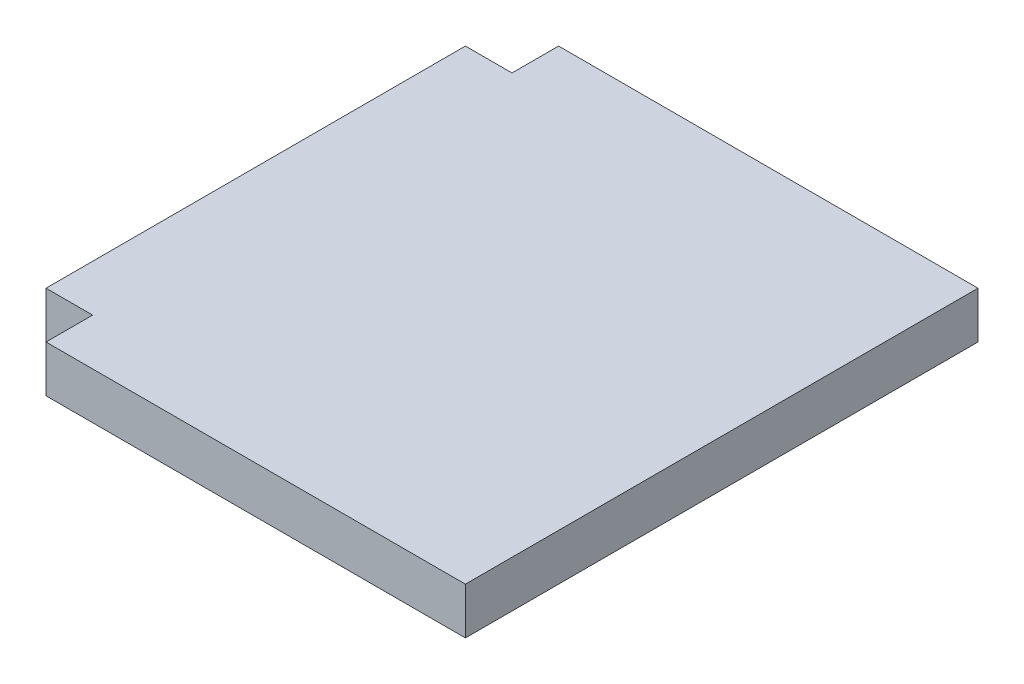
from build123d import *

# Parameters (mm, degrees)
CROQUIS1_W              = 500
CROQUIS1_H              = 550
SALIENTE_EXTRUIR1_DEPTH = 50
CROQUIS2_W              = 50
CROQUIS2_H              = 50
CORTAR_EXTRUIR1_DEPTH   = 50
MATRIZL1_COUNT          = 2
MATRIZL1_PITCH          = 500


with BuildPart() as part:
    # Croquis1 → Saliente-Extruir1 (new body)
    with BuildSketch(Plane(origin=(0, 0, 0), x_dir=(1, 0, 0), z_dir=(0, 1, 0))):
        Rectangle(CROQUIS1_W, CROQUIS1_H)
    extrude(amount=SALIENTE_EXTRUIR1_DEPTH)

    # Croquis2 → Cortar-Extruir1 (cut)
    with BuildSketch(Plane(origin=(0, 50, 0), x_dir=(1, 0, 0), z_dir=(0, 1, 0))):
        with Locations((-225, 250)):
            Rectangle(CROQUIS2_W, CROQUIS2_H)
    cortar_extruir1 = extrude(amount=-CORTAR_EXTRUIR1_DEPTH, mode=Mode.SUBTRACT)

    # MatrizL1: Cortar-Extruir1 ×2
    with Locations(*[(0, 0, i * MATRIZL1_PITCH) for i in range(1, MATRIZL1_COUNT)]):
        add(cortar_extruir1, mode=Mode.SUBTRACT)


solid = part.part
